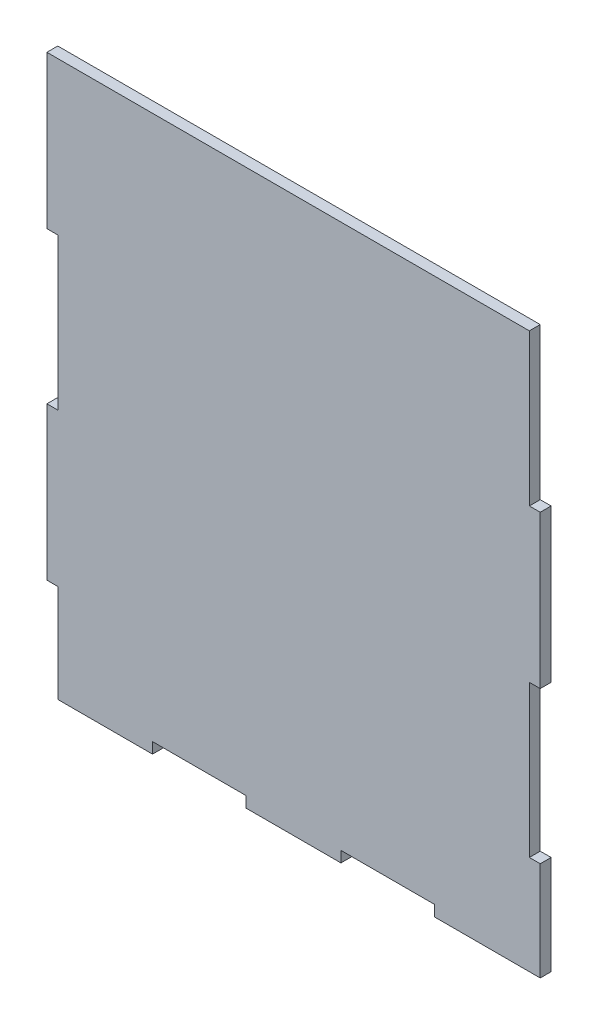
from build123d import *

# Parameters (mm, degrees)
BOSS_EXTRUDE1_DEPTH = 3


with BuildPart() as part:
    # Sketch1 → Boss-Extrude1 (new body)
    with BuildSketch(Plane.XY):
        Polygon((68.741444867, -77.144486692), (65.741444867, -77.144486692), (39.621444867, -77.144486692), (39.621444867, -74.144486692), (13.801444867, -74.144486692), (13.801444867, -77.144486692), (-12.318555133, -77.144486692), (-12.318555133, -74.144486692), (-38.138555133, -74.144486692), (-38.138555133, -77.144486692), (-64.258555133, -77.144486692), (-64.258555133, -50.165915272), (-67.258555133, -50.165915272), (-67.258555133, -8.058772412), (-64.258555133, -8.058772412), (-64.258555133, 33.748370448), (-67.258555133, 33.748370448), (-67.258555133, 75.855513308), (65.741444867, 75.855513308), (65.741444867, 34.048370448), (68.741444867, 34.048370448), (68.741444867, -8.058772412), (65.741444867, -8.058772412), (65.741444867, -49.865915272), (68.741444867, -49.865915272), align=None)
    extrude(amount=BOSS_EXTRUDE1_DEPTH)


solid = part.part
